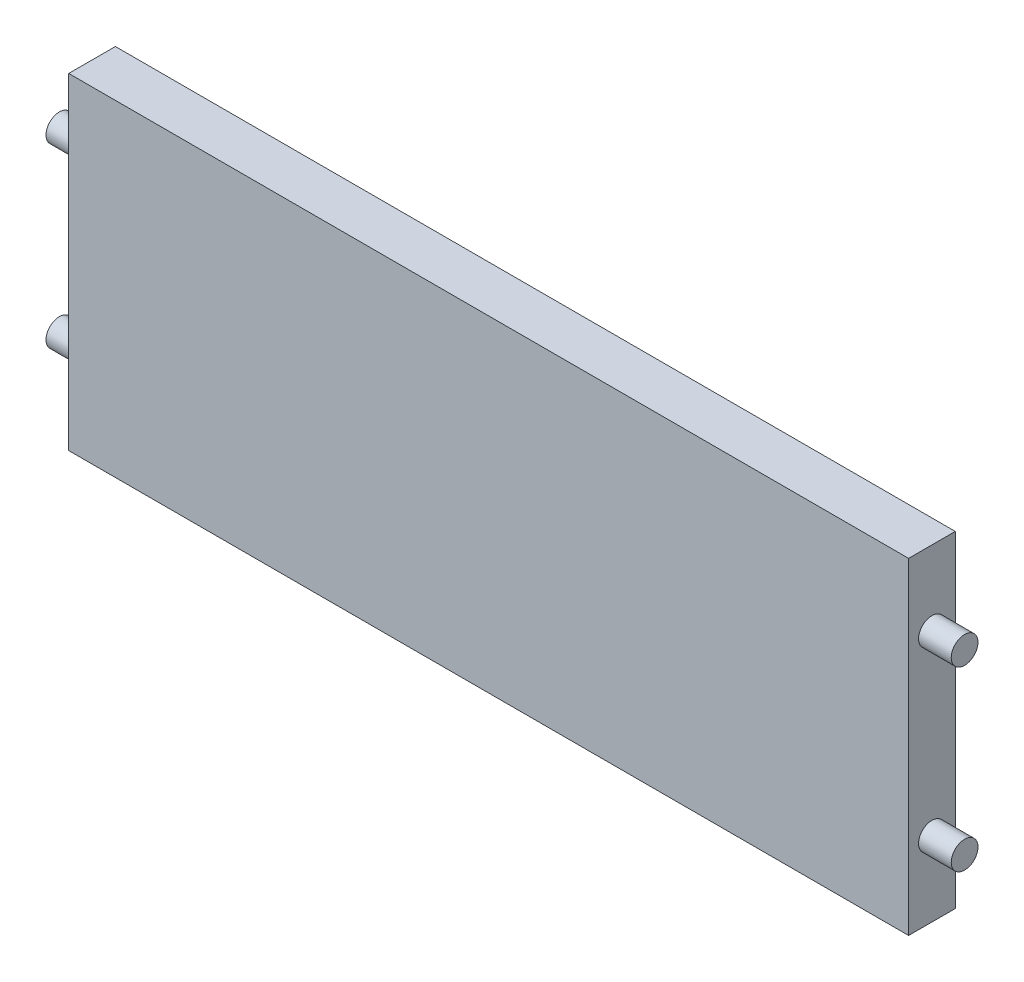
from build123d import *

# Parameters (mm, degrees)
SKETCH1_W           = 90
SKETCH1_H           = 35
BOSS_EXTRUDE1_DEPTH = 5
SKETCH2_R           = 1.435
BOSS_EXTRUDE2_DEPTH = 3.5
BOSS_EXTRUDE3_START = 3.5
SKETCH3_R           = 1.435
BOSS_EXTRUDE3_DEPTH = 3.5


with BuildPart() as part:
    # Sketch1 → Boss-Extrude1 (new body)
    with BuildSketch(Plane.XY):
        Rectangle(SKETCH1_W, SKETCH1_H)
    extrude(amount=BOSS_EXTRUDE1_DEPTH)

    # Sketch2 → Boss-Extrude2 (add)
    with BuildSketch(Plane(origin=(45, 0, 0), x_dir=(0, 0, -1), z_dir=(1, 0, 0))):
        with Locations(Location((-2.5, 9.5, 0), (0, 0, 180))):
            Circle(SKETCH2_R)
        with Locations(Location((-2.5, -9.5, 0), (0, 0, 180))):
            Circle(SKETCH2_R)
    extrude(amount=BOSS_EXTRUDE2_DEPTH)

    # Sketch3 → Boss-Extrude3 (add)
    with BuildSketch(Plane.ZY.offset(45).offset(BOSS_EXTRUDE3_START)):
        with Locations((2.5, 9.5)):
            Circle(SKETCH3_R)
        with Locations((2.5, -9.5)):
            Circle(SKETCH3_R)
    extrude(amount=-BOSS_EXTRUDE3_DEPTH)


solid = part.part
